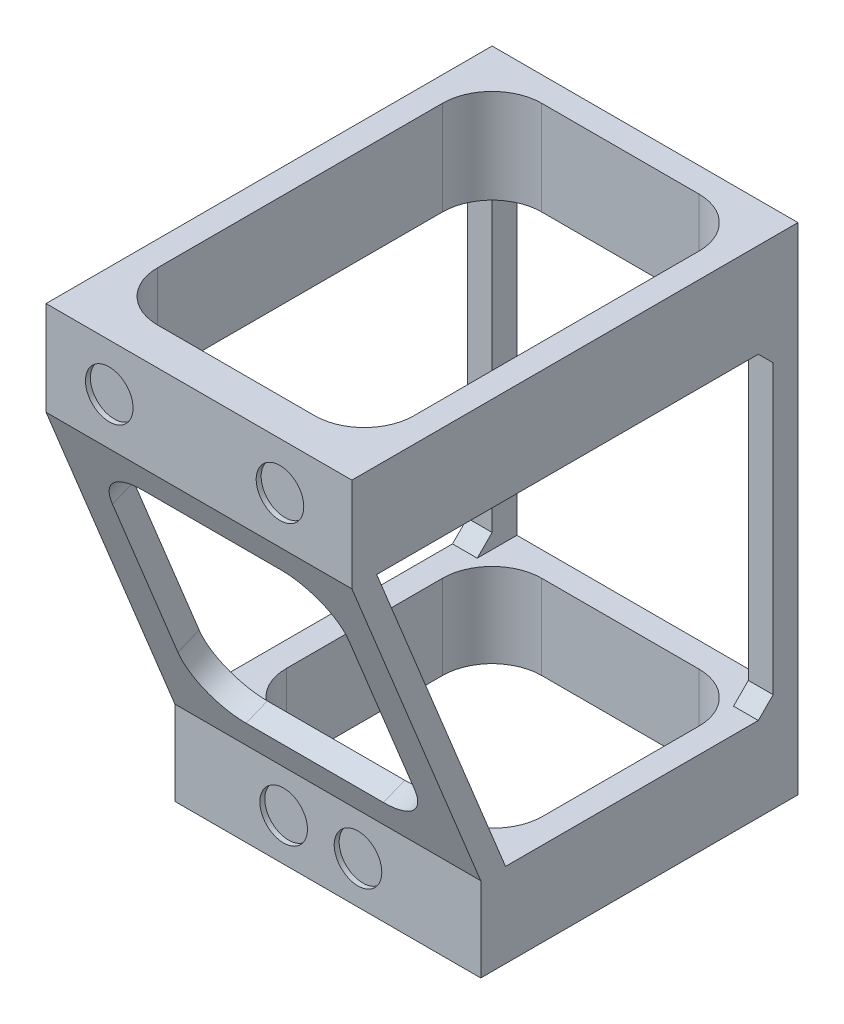
from build123d import *

# Parameters (mm, degrees)
BOSS_EXTRUDE1_DEPTH = 58.71
SKETCH4_R           = 4.8
CUT_EXTRUDE1_DEPTH  = 1
SKETCH5_R           = 4.8
CUT_EXTRUDE2_DEPTH  = 1
SKETCH6_W           = 19
SKETCH6_H           = 26
BOSS_EXTRUDE3_DEPTH = 58.71
SKETCH7_W           = 58.71
SKETCH7_H           = 17
SKETCH7_H_2         = 19
BOSS_EXTRUDE4_DEPTH = 59
BOSS_EXTRUDE5_DEPTH = 3
CUT_EXTRUDE3_DEPTH  = 17
CUT_EXTRUDE4_START  = -19
CUT_EXTRUDE4_DEPTH  = 19
CUT_EXTRUDE5_DEPTH  = 4.632332886
SKETCH12_W          = 5
SKETCH12_H          = 5
BOSS_EXTRUDE6_DEPTH = 100
CHAMFER1_SIZE       = 3


with BuildPart() as part:
    # Sketch3 → Boss-Extrude1 (new body)
    with BuildSketch(Plane.YZ):
        Polygon((0, 5), (0, 0), (17, 0), (81, 26), (100, 26), (100, 31), (81, 31), (17, 5), align=None)
    extrude(amount=BOSS_EXTRUDE1_DEPTH)

    # Sketch4 → Cut-Extrude1 (cut)
    with BuildSketch(Plane.XY.offset(31)):
        with Locations((12.75, 90.5)):
            Circle(SKETCH4_R)
        with Locations((47.2, 90.5)):
            Circle(SKETCH4_R)
    extrude(amount=-CUT_EXTRUDE1_DEPTH, mode=Mode.SUBTRACT)

    # Sketch5 → Cut-Extrude2 (cut)
    with BuildSketch(Plane.XY.offset(5)):
        with Locations((21.94, 8.5)):
            Circle(SKETCH5_R)
        with Locations((36.94, 8.5)):
            Circle(SKETCH5_R)
    extrude(amount=-CUT_EXTRUDE2_DEPTH, mode=Mode.SUBTRACT)

    # Sketch6 → Boss-Extrude3 (add)
    with BuildSketch(Plane.YZ.offset(58.71)):
        with Locations((90.5, 13)):
            Rectangle(SKETCH6_W, SKETCH6_H)
    extrude(amount=-BOSS_EXTRUDE3_DEPTH)

    # Sketch7 → Boss-Extrude4 (add)
    with BuildSketch(Plane(origin=(0, 0, 0), x_dir=(1, 0, 0), z_dir=(0, 0, -1))):
        with Locations((29.355, -8.5)):
            Rectangle(SKETCH7_W, SKETCH7_H)
        with Locations((29.355, -90.5)):
            Rectangle(SKETCH7_W, SKETCH7_H_2)
    extrude(amount=BOSS_EXTRUDE4_DEPTH)

    # Sketch8 → Boss-Extrude5 (add)
    with BuildSketch(Plane.YZ.offset(58.71)):
        Polygon((100, 31), (81, 31), (17, 5), (0, 5), (0, -59), (17, -59), (17, 0), (81, 26), (81, -59), (100, -59), align=None)
    extrude(amount=BOSS_EXTRUDE5_DEPTH)

    # Sketch9 → Cut-Extrude3 (cut)
    with BuildSketch(Plane.XZ):
        with BuildLine():
            Line((15, -2.5), (46.71, -2.5))
            ThreePointArc((46.71, -2.5), (53.781067812, -5.428932188), (56.71, -12.5))
            Line((56.71, -12.5), (56.71, -44))
            ThreePointArc((56.71, -44), (53.781067812, -51.071067812), (46.71, -54))
            Line((46.71, -54), (15, -54))
            ThreePointArc((15, -54), (7.928932188, -51.071067812), (5, -44))
            Line((5, -44), (5, -12.5))
            ThreePointArc((5, -12.5), (7.928932188, -5.428932188), (15, -2.5))
        make_face()
    extrude(amount=-CUT_EXTRUDE3_DEPTH, mode=Mode.SUBTRACT)

    # Sketch10 → Cut-Extrude4 (cut)
    with BuildSketch(Plane(origin=(0, 100, 0), x_dir=(-1, 0, 0), z_dir=(0, 1, 0)).offset(CUT_EXTRUDE4_START)):
        with BuildLine():
            Line((-46.71, 23.5), (-15, 23.5))
            ThreePointArc((-15, 23.5), (-7.928932188, 20.571067812), (-5, 13.5))
            Line((-5, 13.5), (-5, -44))
            ThreePointArc((-5, -44), (-7.928932188, -51.071067812), (-15, -54))
            Line((-15, -54), (-46.71, -54))
            ThreePointArc((-46.71, -54), (-53.781067812, -51.071067812), (-56.71, -44))
            Line((-56.71, -44), (-56.71, 13.5))
            ThreePointArc((-56.71, 13.5), (-53.781067812, 20.571067812), (-46.71, 23.5))
        make_face()
    extrude(amount=CUT_EXTRUDE4_DEPTH, mode=Mode.SUBTRACT)

    # Sketch11 → Cut-Extrude5 (cut)
    with BuildSketch(Plane(origin=(0, 0.664710813, -1.636211232), x_dir=(1, 0, 0), z_dir=(0, -0.376377046955938, 0.9264665771223093))):
        with BuildLine():
            Line((17, 79.711481203), (44.71, 79.711481203))
            ThreePointArc((44.71, 79.711481203), (51.781067812, 76.782549014), (54.71, 69.711481203))
            Line((54.71, 69.711481203), (54.71, 34.631817046))
            ThreePointArc((54.71, 34.631817046), (51.781067812, 27.560749234), (44.71, 24.631817046))
            Line((44.71, 24.631817046), (17, 24.631817046))
            ThreePointArc((17, 24.631817046), (9.928932188, 27.560749234), (7, 34.631817046))
            Line((7, 34.631817046), (7, 69.711481203))
            ThreePointArc((7, 69.711481203), (9.928932188, 76.782549014), (17, 79.711481203))
        make_face()
    extrude(amount=-CUT_EXTRUDE5_DEPTH, mode=Mode.SUBTRACT)

    # Sketch12 → Boss-Extrude6 (add)
    with BuildSketch(Plane.XZ):
        with Locations((2.5, -56.5)):
            Rectangle(SKETCH12_W, SKETCH12_H)
        with Locations((59.21, -56.5)):
            Rectangle(SKETCH12_W, SKETCH12_H)
    extrude(amount=-BOSS_EXTRUDE6_DEPTH)

    # Chamfer1
    chamfer1_edges = [part.edges().sort_by_distance(p)[0] for p in [
        (2.5, 17, -54),
        (2.5, 81, -54),
        (59.21, 81, -54),
        (59.21, 17, -54),
    ]]
    chamfer(chamfer1_edges, length=CHAMFER1_SIZE)


solid = part.part
